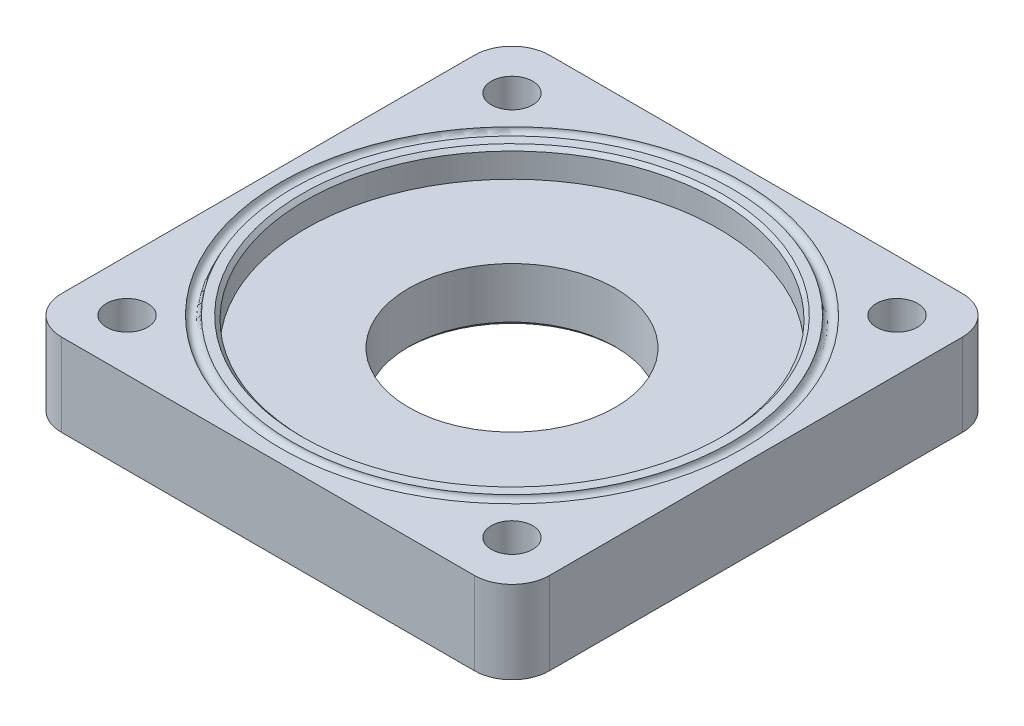
from build123d import *

# Parameters (mm, degrees)
SKETCH1_W           = 130
SKETCH1_H           = 130
SKETCH1_R           = 5.5
SKETCH1_R_2         = 27.5
BOSS_EXTRUDE1_DEPTH = 22
FILLET1_R           = 10
SKETCH2_R           = 55
CUT_EXTRUDE1_DEPTH  = 7.5
SKETCH4_R           = 1.5
CUT_EXTRUDE2_DEPTH  = 22.5
SKETCH8_R           = 1.5
CHAMFER1_SIZE       = 1


with BuildPart() as part:
    # Sketch1 → Boss-Extrude1 (new body)
    with BuildSketch(Plane(origin=(0, 0, 0), x_dir=(1, 0, 0), z_dir=(0, 1, 0))):
        Rectangle(SKETCH1_W, SKETCH1_H)
        with Locations(Location((51.265241636, 51.265241636, 0), (0, 0, 270))):
            Circle(SKETCH1_R, mode=Mode.SUBTRACT)
        with Locations(Location((-51.265241636, 51.265241636, 0), (0, 0, 270))):
            Circle(SKETCH1_R, mode=Mode.SUBTRACT)
        with Locations(Location((51.265241636, -51.265241636, 0), (0, 0, 270))):
            Circle(SKETCH1_R, mode=Mode.SUBTRACT)
        with Locations(Location((-51.265241636, -51.265241636, 0), (0, 0, 270))):
            Circle(SKETCH1_R, mode=Mode.SUBTRACT)
        with Locations(Location((0, 0, 0), (0, 0, 270))):
            Circle(SKETCH1_R_2, mode=Mode.SUBTRACT)
    extrude(amount=BOSS_EXTRUDE1_DEPTH)

    # Fillet1
    fillet1_edges = [part.edges().sort_by_distance(p)[0] for p in [
        (65, 11, 65),
        (-65, 11, 65),
        (-65, 11, -65),
        (65, 11, -65),
    ]]
    fillet(fillet1_edges, radius=FILLET1_R)

    # Sketch2 → Cut-Extrude1 (cut)
    with BuildSketch(Plane(origin=(0, 22, 0), x_dir=(1, 0, 0), z_dir=(0, 1, 0))):
        with Locations(Location((0, 0, 0), (0, 0, 270))):
            Circle(SKETCH2_R)
    extrude(amount=-CUT_EXTRUDE1_DEPTH, mode=Mode.SUBTRACT)

    # Cut-Sweep2: sweep along a path in Sketch3
    with BuildLine(Plane.XZ) as cut_sweep2_path:
        CenterArc((0, 0), 32.5, 0, 360)
    # Sketch4 → Cut-Sweep2 (sweep, cut)
    with BuildSketch(Plane.XY):
        with Locations((32.5, 0)):
            Circle(SKETCH4_R)
    sweep(path=cut_sweep2_path.line, mode=Mode.SUBTRACT)

    # Sketch6 → Cut-Extrude2 (cut, symmetric)
    with BuildSketch(Plane.XY):
        Polygon((-65, 0), (-40, 0), (-65, 11), align=None)
    extrude(amount=CUT_EXTRUDE2_DEPTH, both=True, mode=Mode.SUBTRACT)

    # Cut-Sweep3: sweep along a path in Sketch7
    with BuildLine(Plane(origin=(0, 22, 0), x_dir=(1, 0, 0), z_dir=(0, 1, 0))) as cut_sweep3_path:
        CenterArc((0, 0), 60, 0, 360)
    # Sketch8 → Cut-Sweep3 (sweep, cut)
    with BuildSketch(Plane.XY):
        with Locations((60, 22)):
            Circle(SKETCH8_R)
    sweep(path=cut_sweep3_path.line, mode=Mode.SUBTRACT)

    # Chamfer1
    chamfer1_edges = [part.edges().sort_by_distance(p)[0] for p in [
        (0, 0, -27.5),
        (0, 22, -55),
    ]]
    chamfer(chamfer1_edges, length=CHAMFER1_SIZE)


solid = part.part
